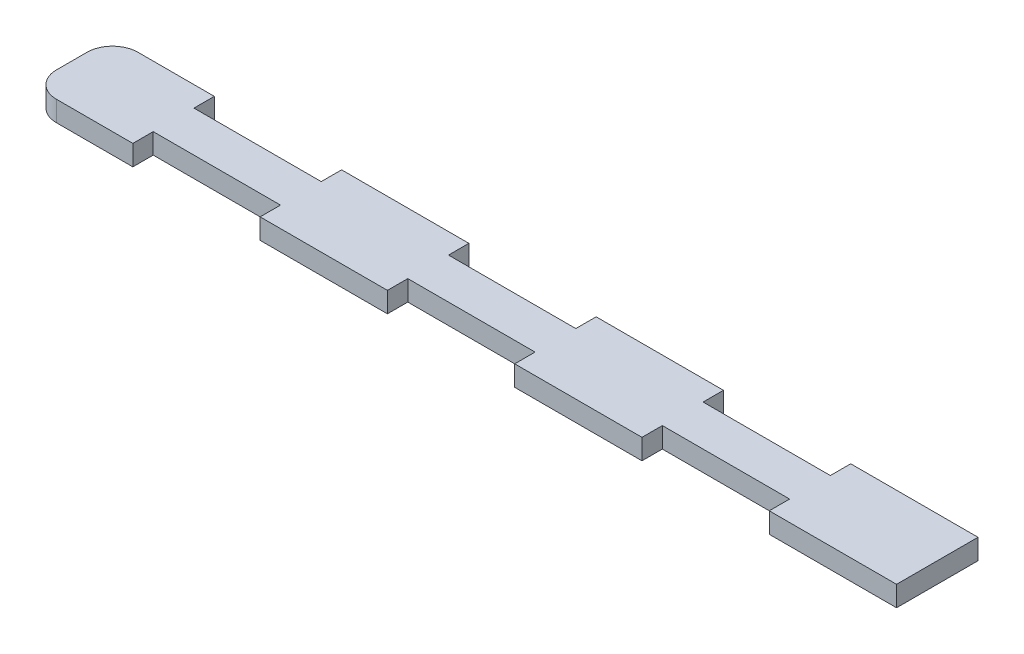
from build123d import *

# Parameters (mm, degrees)
SKETCH1_W           = 170
SKETCH1_H           = 16
BOSS_EXTRUDE1_DEPTH = 2
SKETCH2_W           = 25
SKETCH2_H           = 4
CUT_EXTRUDE1_DEPTH  = 86.469292731
FILLET1_R           = 5


with BuildPart() as part:
    # Sketch1 → Boss-Extrude1 (new, symmetric)
    with BuildSketch(Plane(origin=(0, 0, 0), x_dir=(1, 0, 0), z_dir=(0, 1, 0))):
        Rectangle(SKETCH1_W, SKETCH1_H)
    extrude(amount=BOSS_EXTRUDE1_DEPTH, both=True)

    # Sketch2 → Cut-Extrude1 (cut, through all)
    with BuildSketch(Plane(origin=(0, 2, 0), x_dir=(1, 0, 0), z_dir=(0, 1, 0))):
        with Locations((47.5, 6)):
            Rectangle(SKETCH2_W, SKETCH2_H)
        with Locations((-2.5, 6)):
            Rectangle(SKETCH2_W, SKETCH2_H)
        with Locations((-52.5, 6)):
            Rectangle(SKETCH2_W, SKETCH2_H)
        with Locations((-102.5, 6)):
            Rectangle(SKETCH2_W, SKETCH2_H)
        with Locations((-152.5, 6)):
            Rectangle(SKETCH2_W, SKETCH2_H)
        with Locations((-202.5, 6)):
            Rectangle(SKETCH2_W, SKETCH2_H)
        with Locations((-252.5, 6)):
            Rectangle(SKETCH2_W, SKETCH2_H)
        with Locations((-302.5, 6)):
            Rectangle(SKETCH2_W, SKETCH2_H)
        with Locations((-352.5, 6)):
            Rectangle(SKETCH2_W, SKETCH2_H)
        with Locations((-402.5, 6)):
            Rectangle(SKETCH2_W, SKETCH2_H)
    cut_extrude1 = extrude(amount=-CUT_EXTRUDE1_DEPTH, mode=Mode.SUBTRACT)

    # Mirror1: Cut-Extrude1 across plane
    add(cut_extrude1.mirror(Plane.XY), mode=Mode.SUBTRACT)

    # Fillet1
    fillet1_edges = [part.edges().sort_by_distance(p)[0] for p in [
        (-85, 0, -8),
        (-85, 0, 8),
    ]]
    fillet(fillet1_edges, radius=FILLET1_R)


solid = part.part
